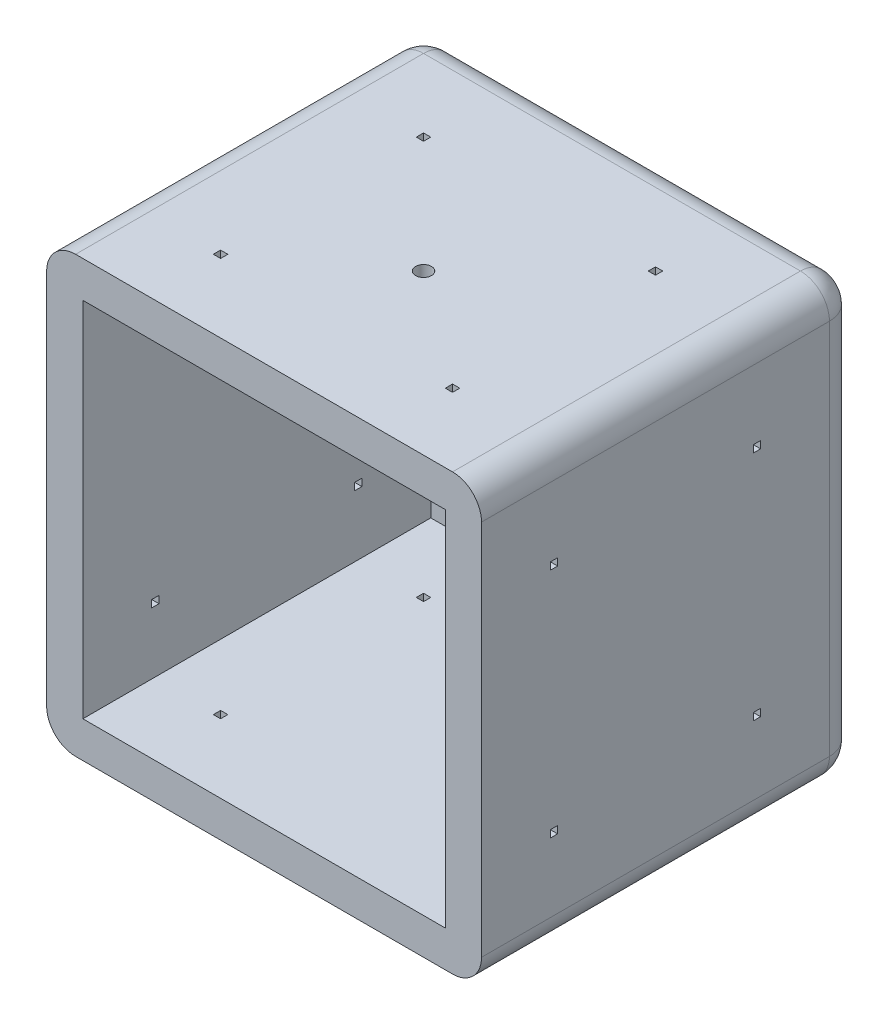
from build123d import *

# Parameters (mm, degrees)
SKETCH1_W           = 300
SKETCH1_H           = 300
BOSS_EXTRUDE1_DEPTH = 260
FILLET1_R           = 20
SKETCH2_W           = 250
SKETCH2_H           = 250
CUT_EXTRUDE1_DEPTH  = 240
SKETCH3_R           = 5.5
CUT_EXTRUDE2_DEPTH  = 25
SKETCH4_W           = 5
SKETCH4_H           = 5
CUT_EXTRUDE3_DEPTH  = 25
SKETCH6_W           = 5
SKETCH6_H           = 5
CUT_EXTRUDE4_DEPTH  = 25
SKETCH7_W           = 5
SKETCH7_H           = 5
CUT_EXTRUDE5_DEPTH  = 25
SKETCH8_W           = 5
SKETCH8_H           = 5
CUT_EXTRUDE6_DEPTH  = 25
SKETCH9_W           = 5
SKETCH9_H           = 5
CUT_EXTRUDE7_DEPTH  = 20


with BuildPart() as part:
    # Sketch1 → Boss-Extrude1 (new body)
    with BuildSketch(Plane.XY):
        with Locations((150, 150)):
            Rectangle(SKETCH1_W, SKETCH1_H)
    extrude(amount=BOSS_EXTRUDE1_DEPTH)

    # Fillet1
    fillet1_edges = [part.edges().sort_by_distance(p)[0] for p in [
        (150, 300, 0),
        (300, 150, 0),
        (150, 0, 0),
        (0, 150, 0),
        (0, 300, 130),
        (300, 300, 130),
        (300, 0, 130),
        (0, 0, 130),
    ]]
    fillet(fillet1_edges, radius=FILLET1_R)

    # Sketch2 → Cut-Extrude1 (cut)
    with BuildSketch(Plane.XY.offset(260)):
        with Locations((150, 150)):
            Rectangle(SKETCH2_W, SKETCH2_H)
    extrude(amount=-CUT_EXTRUDE1_DEPTH, mode=Mode.SUBTRACT)

    # Sketch3 → Cut-Extrude2 (cut)
    with BuildSketch(Plane(origin=(0, 300, 0), x_dir=(1, 0, 0), z_dir=(0, 1, 0))):
        with Locations(Location((150, -150, 0), (0, 0, 270))):
            Circle(SKETCH3_R)
    extrude(amount=-CUT_EXTRUDE2_DEPTH, mode=Mode.SUBTRACT)

    # Sketch4 → Cut-Extrude3 (cut)
    with BuildSketch(Plane(origin=(0, 300, 0), x_dir=(1, 0, 0), z_dir=(0, 1, 0))):
        with Locations((70, -70)):
            Rectangle(SKETCH4_W, SKETCH4_H)
        with Locations((70, -210)):
            Rectangle(SKETCH4_W, SKETCH4_H)
        with Locations((230, -70)):
            Rectangle(SKETCH4_W, SKETCH4_H)
        with Locations((230, -210)):
            Rectangle(SKETCH4_W, SKETCH4_H)
    extrude(amount=-CUT_EXTRUDE3_DEPTH, mode=Mode.SUBTRACT)

    # Sketch6 → Cut-Extrude4 (cut)
    with BuildSketch(Plane(origin=(300, 0, 0), x_dir=(0, 0, -1), z_dir=(1, 0, 0))):
        with Locations((-210, 230)):
            Rectangle(SKETCH6_W, SKETCH6_H)
        with Locations((-210, 70)):
            Rectangle(SKETCH6_W, SKETCH6_H)
        with Locations((-70, 230)):
            Rectangle(SKETCH6_W, SKETCH6_H)
        with Locations((-70, 70)):
            Rectangle(SKETCH6_W, SKETCH6_H)
    extrude(amount=-CUT_EXTRUDE4_DEPTH, mode=Mode.SUBTRACT)

    # Sketch7 → Cut-Extrude5 (cut)
    with BuildSketch(Plane.XZ):
        with Locations((70, 210)):
            Rectangle(SKETCH7_W, SKETCH7_H)
        with Locations((70, 70)):
            Rectangle(SKETCH7_W, SKETCH7_H)
        with Locations((230, 210)):
            Rectangle(SKETCH7_W, SKETCH7_H)
        with Locations((230, 70)):
            Rectangle(SKETCH7_W, SKETCH7_H)
    extrude(amount=-CUT_EXTRUDE5_DEPTH, mode=Mode.SUBTRACT)

    # Sketch8 → Cut-Extrude6 (cut)
    with BuildSketch(Plane.ZY):
        with Locations((70, 230)):
            Rectangle(SKETCH8_W, SKETCH8_H)
        with Locations((70, 70)):
            Rectangle(SKETCH8_W, SKETCH8_H)
        with Locations((210, 230)):
            Rectangle(SKETCH8_W, SKETCH8_H)
        with Locations((210, 70)):
            Rectangle(SKETCH8_W, SKETCH8_H)
    extrude(amount=-CUT_EXTRUDE6_DEPTH, mode=Mode.SUBTRACT)

    # Sketch9 → Cut-Extrude7 (cut)
    with BuildSketch(Plane(origin=(0, 0, 0), x_dir=(-1, 0, 0), z_dir=(0, 0, -1))):
        with Locations((-230, 230)):
            Rectangle(SKETCH9_W, SKETCH9_H)
        with Locations((-230, 70)):
            Rectangle(SKETCH9_W, SKETCH9_H)
        with Locations((-70, 230)):
            Rectangle(SKETCH9_W, SKETCH9_H)
        with Locations((-70, 70)):
            Rectangle(SKETCH9_W, SKETCH9_H)
    extrude(amount=-CUT_EXTRUDE7_DEPTH, mode=Mode.SUBTRACT)


solid = part.part
